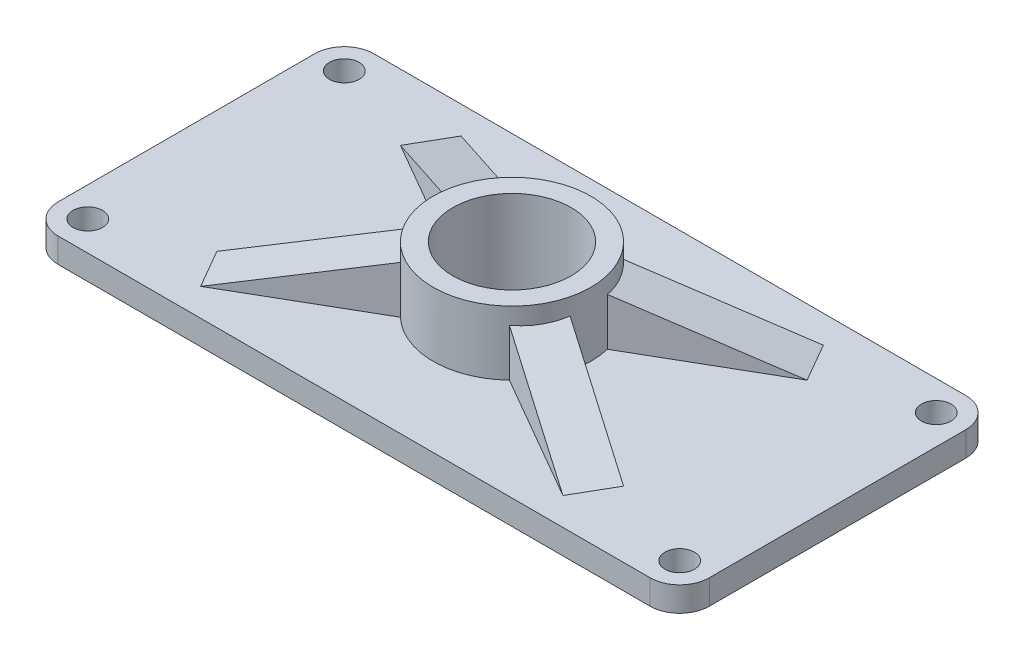
from build123d import *

# Parameters (mm, degrees)
SKETCH1_R           = 3
SKETCH1_R_2         = 16
BOSS_EXTRUDE1_DEPTH = 5
SKETCH1_3_R         = 16
SKETCH1_3_R_2       = 12
BOSS_EXTRUDE2_DEPTH = 18
BOSS_EXTRUDE3_DEPTH = 4.5


with BuildPart() as part:
    # Sketch1 → Boss-Extrude1 (new body)
    with BuildSketch(Plane(origin=(0, 0, 0), x_dir=(1, 0, 0), z_dir=(0, 1, 0))):
        with BuildLine():
            Line((60, 32), (-60, 32))
            ThreePointArc((-60, 32), (-64.242640687, 30.242640687), (-66, 26))
            Line((-66, 26), (-66, -26))
            ThreePointArc((-66, -26), (-64.242640687, -30.242640687), (-60, -32))
            Line((-60, -32), (60, -32))
            ThreePointArc((60, -32), (64.242640687, -30.242640687), (66, -26))
            Line((66, -26), (66, 26))
            ThreePointArc((66, 26), (64.242640687, 30.242640687), (60, 32))
        make_face()
        with Locations((-60, -26)):
            Circle(SKETCH1_R, mode=Mode.SUBTRACT)
        with Locations((60, -26)):
            Circle(SKETCH1_R, mode=Mode.SUBTRACT)
        with Locations((-60, 26)):
            Circle(SKETCH1_R, mode=Mode.SUBTRACT)
        Circle(SKETCH1_R_2, mode=Mode.SUBTRACT)
        with Locations((60, 26)):
            Circle(SKETCH1_R, mode=Mode.SUBTRACT)
    extrude(amount=BOSS_EXTRUDE1_DEPTH)

    # Sketch1<3> → Boss-Extrude2 (add)
    with BuildSketch(Plane(origin=(0, 0, 0), x_dir=(1, 0, 0), z_dir=(0, 1, 0))):
        Circle(SKETCH1_3_R)
        Circle(SKETCH1_3_R_2, mode=Mode.SUBTRACT)
    extrude(amount=BOSS_EXTRUDE2_DEPTH)

    # Sketch2 → Boss-Extrude3 (add, symmetric)
    with BuildSketch(Plane(origin=(0, 0, 0), x_dir=(0, -1, 0), z_dir=(-0.49999999999999495, 0, -0.8660254037844416))):
        Polygon((-5, 12), (-5, 45), (-15.722349976, 12), align=None)
        Polygon((-15.722349976, -12), (-5, -12), (-5, -45), align=None)
    boss_extrude3 = extrude(amount=BOSS_EXTRUDE3_DEPTH, both=True)

    # Mirror1: Boss-Extrude3 across plane
    add(boss_extrude3.mirror(Plane.XY))


solid = part.part
